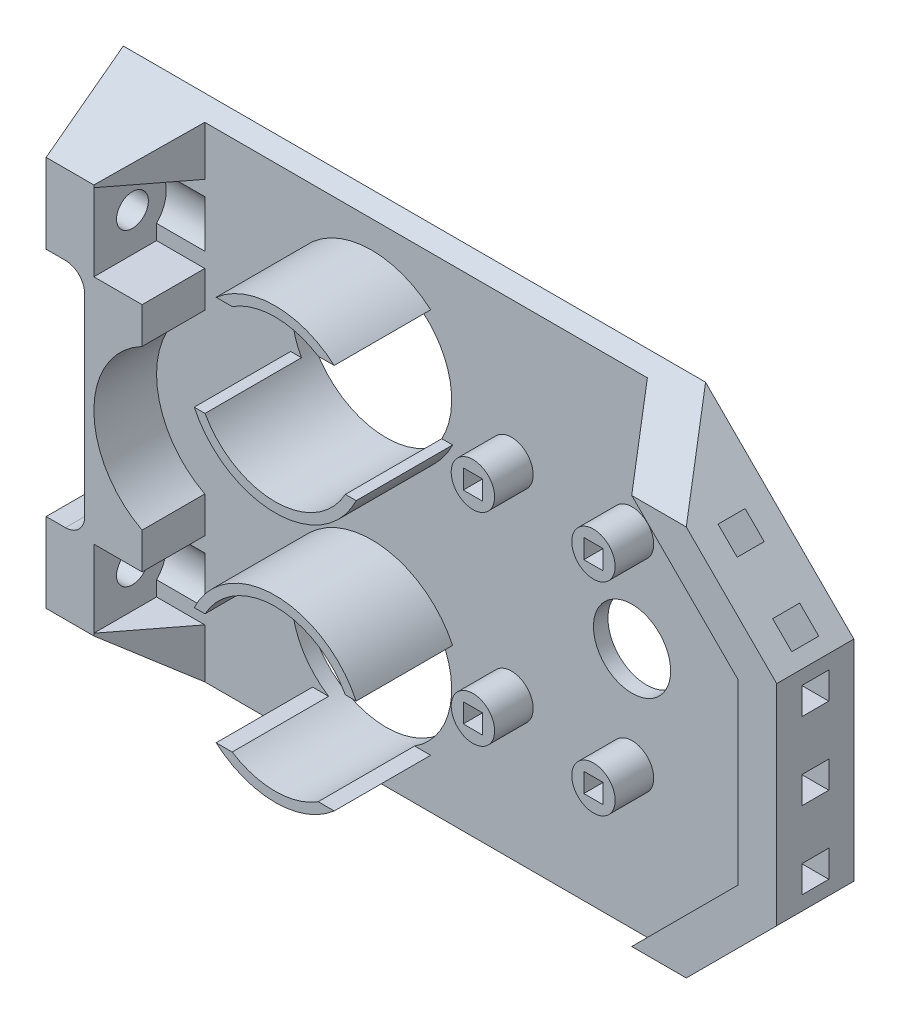
from build123d import *
from build123d.topology import SkipClean

# Parameters (mm, degrees)
ESBO_O1_R                 = 8.3
RESSALTO_EXTRUS_O1_DEPTH  = 1.5
RESSALTO_EXTRUS_O2_DEPTH  = 6
ESBO_O3_W                 = 2.8
ESBO_O3_H                 = 2.8
CORTE_EXTRUS_O1_DEPTH     = 37.142081
ESBO_O4_W                 = 2.8
ESBO_O4_H                 = 2.8
CORTE_EXTRUS_O2_DEPTH     = 53.081667
ESBO_O6_W                 = 5
ESBO_O6_H                 = 25
RESSALTO_EXTRUS_O5_DEPTH  = 7.5
ESBO_O7_W                 = 2.8
ESBO_O7_H                 = 2.8
CORTE_EXTRUS_O3_DEPTH     = 60
RESSALTO_EXTRUS_O3_DEPTH  = 10
ESBO_O8_W                 = 60
ESBO_O8_H                 = 52.5
ESBO_O8_R                 = 8.3
RESSALTO_EXTRUS_O6_DEPTH  = 1.5
CORTE_EXTRUS_O4_DEPTH     = 42.098206
RESSALTO_EXTRUS_O7_DEPTH  = 6.5
ESBO_O14_W                = 5.7
ESBO_O14_H                = 52.5
CORTE_EXTRUS_O8_DEPTH     = 4.5
CORTE_EXTRUS_O9_DEPTH     = 41.657871
CORTE_EXTRUS_O13_DEPTH    = 6.25
CORTE_EXTRUS_O14_DEPTH    = 6.25
ESBO_O12_R                = 1.65
CORTE_EXTRUS_O15_DEPTH    = 4.5
CORTE_EXTRUS_O17_DEPTH    = 62.398717
ESBO_O20_R                = 3.5
CORTE_EXTRUS_O18_DEPTH    = 5
RESSALTO_EXTRUS_O8_START  = 2.95
ESBO_O21_R                = 1.65
RESSALTO_EXTRUS_O8_DEPTH  = 2.95
ESBO_O22_W                = 2.8
ESBO_O22_H                = 2.8
RESSALTO_EXTRUS_O9_DEPTH  = 1.25
CORTE_EXTRUS_O19_DEPTH    = 6
ESBO_O24_W                = 8
ESBO_O24_H                = 50.25
RESSALTO_EXTRUS_O10_DEPTH = 6.5
CORTE_EXTRUS_O20_DEPTH    = 62.22257
CORTE_EXTRUS_O21_REACH    = 67.143
ESBO_O26_W                = 2.8
ESBO_O26_H                = 2.8
CORTE_EXTRUS_O22_REACH    = 67.143
CORTE_EXTRUS_O23_DEPTH    = 6.5
CORTE_EXTRUS_O24_DEPTH    = 43.019341
ESBO_O32_R                = 8.3
RESSALTO_EXTRUS_O11_DEPTH = 1.5
ESBO_O29_R                = 8.3
CORTE_EXTRUS_O27_DEPTH    = 42.588761
RESSALTO_EXTRUS_O12_DEPTH = 10
ESBO_O36_W                = 27.015234
ESBO_O36_H                = 55.93915
CORTE_EXTRUS_O28_DEPTH    = 10
RESSALTO_EXTRUS_O13_DEPTH = 1.5
ESBO_O40_R                = 2.25
RESSALTO_EXTRUS_O14_DEPTH = 4
ESBO_O37_R                = 4
ESBO_O37_W                = 2
ESBO_O37_H                = 2
CORTE_EXTRUS_O29_DEPTH    = 57.334381
ESBO_O41_W                = 2
ESBO_O41_H                = 2
RESSALTO_EXTRUS_O15_DEPTH = 1
RESSALTO_EXTRUS_O16_DEPTH = 6.5
ESBO_O44_W                = 2.8
ESBO_O44_H                = 2.8
CORTE_EXTRUS_O30_DEPTH    = 12.5
ESBO_O45_W                = 2.8
ESBO_O45_H                = 2.8
CORTE_EXTRUS_O31_DEPTH    = 5.5
ESBO_O46_W                = 2.8
ESBO_O46_H                = 2.8
CORTE_EXTRUS_O32_DEPTH    = 5.5
CORTE_EXTRUS_O33_START    = -40
CORTE_EXTRUS_O33_DEPTH    = 45.5
ESBO_O49_W                = 32.528758
ESBO_O49_H                = 8
CORTE_EXTRUS_O34_DEPTH    = 15.5


with BuildPart() as part:
    # Esboço1 → Ressalto-extrusão1 (new body)
    with BuildSketch(Plane.XY):
        Polygon((-25, -12.5), (-25, 12.5), (25, 12.5), (25, -12.5), (15, -12.5), (-15, -12.5), align=None)
        with Locations((-13, 0)):
            Circle(ESBO_O1_R, mode=Mode.SUBTRACT)
        with Locations(Location((13, 0, 0), (0, 0, 180))):
            Circle(ESBO_O1_R, mode=Mode.SUBTRACT)
    extrude(amount=RESSALTO_EXTRUS_O1_DEPTH)

    # Esboço2 → Ressalto-extrusão2 (add)
    with BuildSketch(Plane.XY.offset(1.5)):
        Polygon((-20, -12.5), (-25, -12.5), (-25, -2.5), (-22, -2.5), (-22, -9.5), (-15, -9.5), (-15, -12.5), align=None)
        Polygon((22, -2.5), (22, -9.5), (15, -9.5), (15, -12.5), (20, -12.5), (25, -12.5), (25, -2.5), align=None)
        Polygon((20, 12.5), (25, 12.5), (25, 2.5), (22, 2.5), (22, 9.5), (15, 9.5), (15, 12.5), align=None)
        Polygon((-22, 2.5), (-22, 9.5), (-15, 9.5), (-15, 12.5), (-20, 12.5), (-25, 12.5), (-25, 2.5), align=None)
    extrude(amount=RESSALTO_EXTRUS_O2_DEPTH)

    # Esboço3 → Corte-extrusão1 (cut, through all)
    with BuildSketch(Plane.XZ.offset(12.5)):
        with Locations((-20, 3.75)):
            Rectangle(ESBO_O3_W, ESBO_O3_H)
        with Locations((20, 3.75)):
            Rectangle(ESBO_O3_W, ESBO_O3_H)
    extrude(amount=-CORTE_EXTRUS_O1_DEPTH, mode=Mode.SUBTRACT)

    # Esboço4 → Corte-extrusão2 (cut, through all)
    with BuildSketch(Plane.ZY.offset(25)):
        with Locations((3.75, 7.5)):
            Rectangle(ESBO_O4_W, ESBO_O4_H)
        with Locations((3.75, -7.5)):
            Rectangle(ESBO_O4_W, ESBO_O4_H)
    extrude(amount=-CORTE_EXTRUS_O2_DEPTH, mode=Mode.SUBTRACT)

    # Esboço6 → Ressalto-extrusão5 (add)
    with BuildSketch(Plane(origin=(0, 0, 0), x_dir=(-1, 0, 0), z_dir=(0, 0, -1))):
        with Locations((-27.5, 0)):
            Rectangle(ESBO_O6_W, ESBO_O6_H)
        with Locations((27.5, 0)):
            Rectangle(ESBO_O6_W, ESBO_O6_H)
    extrude(amount=-RESSALTO_EXTRUS_O5_DEPTH)

    # Esboço7 → Corte-extrusão3 (cut)
    with BuildSketch(Plane(origin=(30, 0, 0), x_dir=(0, 0, -1), z_dir=(1, 0, 0))):
        with Locations((-3.75, -7.5)):
            Rectangle(ESBO_O7_W, ESBO_O7_H)
        with Locations((-3.75, 7.5)):
            Rectangle(ESBO_O7_W, ESBO_O7_H)
    extrude(amount=-CORTE_EXTRUS_O3_DEPTH, mode=Mode.SUBTRACT)

    # Esboço5 → Ressalto-extrusão3 (add)
    with SkipClean():  # the faces are left unmerged after this step: merging them gives an invalid solid
        with BuildSketch(Plane.XY.offset(1.5)):
            with BuildLine():
                Line((-9, -7.272551), (-9, -8.395832))
                ThreePointArc((-9, -8.395832), (-3.7, 0), (-9, 8.395832))
                Line((-9, 8.395832), (-9, 7.272551))
                ThreePointArc((-9, 7.272551), (-4.7, 0), (-9, -7.272551))
            make_face()
            with BuildLine():
                Line((-17, -7.272551), (-17, -8.395832))
                ThreePointArc((-17, -8.395832), (-22.3, 0), (-17, 8.395832))
                Line((-17, 8.395832), (-17, 7.272551))
                ThreePointArc((-17, 7.272551), (-21.3, 0), (-17, -7.272551))
            make_face()
            with BuildLine():
                Line((9, -7.272551), (9, -8.395832))
                ThreePointArc((9, -8.395832), (3.7, 0), (9, 8.395832))
                Line((9, 8.395832), (9, 7.272551))
                ThreePointArc((9, 7.272551), (4.7, 0), (9, -7.272551))
            make_face()
            with BuildLine():
                Line((17, 8.395832), (17, 7.272551))
                ThreePointArc((17, 7.272551), (21.3, 0), (17, -7.272551))
                Line((17, -7.272551), (17, -8.395832))
                ThreePointArc((17, -8.395832), (22.3, 0), (17, 8.395832))
            make_face()
        extrude(amount=RESSALTO_EXTRUS_O3_DEPTH)

    # Esboço8 → Ressalto-extrusão6 (add)
    with SkipClean():  # the faces are left unmerged after this step: merging them gives an invalid solid
        with BuildSketch(Plane(origin=(0, 0, 0), x_dir=(-1, 0, 0), z_dir=(0, 0, -1))):
            Rectangle(ESBO_O8_W, ESBO_O8_H)
            with Locations(Location((13, 0, 0), (0, 0, 298.81138))):
                Circle(ESBO_O8_R, mode=Mode.SUBTRACT)
            with Locations((-13, 0)):
                Circle(ESBO_O8_R, mode=Mode.SUBTRACT)
        extrude(amount=-RESSALTO_EXTRUS_O6_DEPTH)

    # Esboço9 → Corte-extrusão4 (cut, through all)
    with SkipClean():  # the faces are left unmerged after this step: merging them gives an invalid solid
        with BuildSketch(Plane.XY.offset(1.5)):
            Polygon((-15, -12.5), (-15, -9.5), (-22, -9.5), (-22, -2.5), (-25, -2.5), (-25, 2.5), (-22, 2.5), (-22, 9.5), (-15, 9.5), (-15, 12.5), (-30, 12.5), (-30, -12.5), align=None)
        extrude(amount=CORTE_EXTRUS_O4_DEPTH, mode=Mode.SUBTRACT)

    # Esboço10 → Ressalto-extrusão7 (add)
    with SkipClean():  # the faces are left unmerged after this step: merging them gives an invalid solid
        with BuildSketch(Plane.XY.offset(1.5)):
            Polygon((-24.3, -26.25), (-24.3, 26.25), (-22.3, 26.25), (-17.3, 26.25), (-17.3, 20), (-22.3, 20), (-22.3, 12), (-17.3, 12), (-17.3, -12), (-22.3, -12), (-22.3, -20), (-17.3, -20), (-17.3, -26.25), (-22.3, -26.25), align=None)
        extrude(amount=RESSALTO_EXTRUS_O7_DEPTH)

    # Esboço14 → Corte-extrusão8 (cut)
    with SkipClean():  # the faces are left unmerged after this step: merging them gives an invalid solid
        with BuildSketch(Plane.XY.offset(1.5)):
            with Locations((-27.15, 0)):
                Rectangle(ESBO_O14_W, ESBO_O14_H)
        extrude(amount=-CORTE_EXTRUS_O8_DEPTH, mode=Mode.SUBTRACT)

    # Esboço15 → Corte-extrusão9 (cut, through all)
    with SkipClean():  # the faces are left unmerged after this step: merging them gives an invalid solid
        with BuildSketch(Plane.XY.offset(8)):
            with BuildLine():
                Line((-17.3, -7.099296), (-17.3, 7.099296))
                ThreePointArc((-17.3, 7.099296), (-21.3, 0), (-17.3, -7.099296))
            make_face()
        extrude(amount=-CORTE_EXTRUS_O9_DEPTH, mode=Mode.SUBTRACT)

    # Esboço11 → Corte-extrusão13 (cut)
    with SkipClean():  # the faces are left unmerged after this step: merging them gives an invalid solid
        with BuildSketch(Plane.XZ.offset(26.25)):
            Polygon((-22.3, 8), (-17.3, 8), (-17.3, 1.5), align=None)
        extrude(amount=-CORTE_EXTRUS_O13_DEPTH, mode=Mode.SUBTRACT)

    # Esboço17 → Corte-extrusão14 (cut)
    with SkipClean():  # the faces are left unmerged after this step: merging them gives an invalid solid
        with BuildSketch(Plane(origin=(0, 26.25, 0), x_dir=(1, 0, 0), z_dir=(0, 1, 0))):
            Polygon((-17.3, -1.5), (-17.3, -8), (-22.3, -8), align=None)
        extrude(amount=-CORTE_EXTRUS_O14_DEPTH, mode=Mode.SUBTRACT)

    # Esboço12 → Corte-extrusão15 (cut)
    with SkipClean():  # the faces are left unmerged after this step: merging them gives an invalid solid
        with BuildSketch(Plane.ZY.offset(24.3)):
            with Locations(Location((4, 16, 0), (0, 0, 270))):
                Circle(ESBO_O12_R)
            with Locations((4, -16)):
                Circle(ESBO_O12_R)
        extrude(amount=-CORTE_EXTRUS_O15_DEPTH, mode=Mode.SUBTRACT)

    # Esboço19 → Corte-extrusão17 (cut, through all)
    with SkipClean():  # the faces are left unmerged after this step: merging them gives an invalid solid
        with BuildSketch(Plane.ZY.offset(24.3)):
            Polygon((0, 26.25), (8, 26.25), (8, 20.25), align=None)
            Polygon((8, -20.25), (0, -26.25), (8, -26.25), align=None)
        extrude(amount=-CORTE_EXTRUS_O17_DEPTH, mode=Mode.SUBTRACT)

    # Esboço20 → Corte-extrusão18 (cut)
    with SkipClean():  # the faces are left unmerged after this step: merging them gives an invalid solid
        with BuildSketch(Plane(origin=(-22.3, 0, 0), x_dir=(0, 0, -1), z_dir=(1, 0, 0))):
            with Locations((-4, -16)):
                Circle(ESBO_O20_R)
            with Locations((-4, 16)):
                Circle(ESBO_O20_R)
        extrude(amount=CORTE_EXTRUS_O18_DEPTH, mode=Mode.SUBTRACT)

    # Esboço21 → Ressalto-extrusão8 (add)
    with SkipClean():  # the faces are left unmerged after this step: merging them gives an invalid solid
        with BuildSketch(Plane.ZY.offset(24.3).offset(RESSALTO_EXTRUS_O8_START)):
            Polygon((0, 26.25), (0, -26.25), (8, -20.25), (8, 20.25), align=None)
            with Locations(Location((4, -16, 0), (0, 0, 270))):
                Circle(ESBO_O21_R, mode=Mode.SUBTRACT)
            with Locations(Location((4, 16, 0), (0, 0, 270))):
                Circle(ESBO_O21_R, mode=Mode.SUBTRACT)
        extrude(amount=-RESSALTO_EXTRUS_O8_DEPTH)

    # Esboço22 → Ressalto-extrusão9 (add)
    with SkipClean():  # the faces are left unmerged after this step: merging them gives an invalid solid
        with BuildSketch(Plane(origin=(30, 0, 0), x_dir=(0, 0, -1), z_dir=(1, 0, 0))):
            Polygon((-1.5, -25.125), (0, -26.25), (0, 26.25), (-1.5, 25.125), (-1.5, 12.5), (-7.5, 12.5), (-7.5, -12.5), (-1.5, -12.5), align=None)
            with Locations((-3.75, -7.5)):
                Rectangle(ESBO_O22_W, ESBO_O22_H, mode=Mode.SUBTRACT)
            with Locations((-3.75, 7.5)):
                Rectangle(ESBO_O22_W, ESBO_O22_H, mode=Mode.SUBTRACT)
        extrude(amount=RESSALTO_EXTRUS_O9_DEPTH)

    # Esboço23 → Corte-extrusão19 (cut)
    with SkipClean():  # the faces are left unmerged after this step: merging them gives an invalid solid
        with BuildSketch(Plane.XY.offset(7.5)):
            Polygon((25, -2.5), (22, -2.5), (22, -9.5), (15, -9.5), (15, -12.5), (31.25, -12.5), (31.25, 12.5), (15, 12.5), (15, 9.5), (22, 9.5), (22, 2.5), (25, 2.5), align=None)
        extrude(amount=-CORTE_EXTRUS_O19_DEPTH, mode=Mode.SUBTRACT)

    # Esboço24 → Ressalto-extrusão10 (add)
    with SkipClean():  # the faces are left unmerged after this step: merging them gives an invalid solid
        with BuildSketch(Plane.XY.offset(1.5)):
            with Locations((27.25, 0)):
                Rectangle(ESBO_O24_W, ESBO_O24_H)
        extrude(amount=RESSALTO_EXTRUS_O10_DEPTH)

    # Esboço25 → Corte-extrusão20 (cut, through all)
    with SkipClean():  # the faces are left unmerged after this step: merging them gives an invalid solid
        with BuildSketch(Plane(origin=(0, 25.125, 0), x_dir=(1, 0, 0), z_dir=(0, 1, 0))):
            Polygon((23.25, -6.5), (23.25, -8), (24.75, -8), align=None)
        extrude(amount=-CORTE_EXTRUS_O20_DEPTH, mode=Mode.SUBTRACT)

    # Esboço26 → Corte-extrusão21 (cut, up to next)
    with BuildSketch(Plane(origin=(31.25, 0, 0), x_dir=(0, 0, -1), z_dir=(1, 0, 0)), mode=Mode.PRIVATE) as corte_extrus_o21_sk1:
        with Locations((-4, 0)):
            Rectangle(ESBO_O26_W, ESBO_O26_H)
    corte_extrus_o21_tool1 = extrude(corte_extrus_o21_sk1.sketch, amount=-CORTE_EXTRUS_O21_REACH, mode=Mode.PRIVATE) & part.part
    # Esboço26 → Corte-extrusão21 (cut, up to next)
    with BuildSketch(Plane(origin=(31.25, 0, 0), x_dir=(0, 0, -1), z_dir=(1, 0, 0)), mode=Mode.PRIVATE) as corte_extrus_o21_sk2:
        with Locations((-4, -8)):
            Rectangle(ESBO_O26_W, ESBO_O26_H)
    corte_extrus_o21_tool2 = extrude(corte_extrus_o21_sk2.sketch, amount=-CORTE_EXTRUS_O21_REACH, mode=Mode.PRIVATE) & part.part
    # Esboço26 → Corte-extrusão21 (cut, up to next)
    with BuildSketch(Plane(origin=(31.25, 0, 0), x_dir=(0, 0, -1), z_dir=(1, 0, 0)), mode=Mode.PRIVATE) as corte_extrus_o21_sk3:
        with Locations((-4, 8)):
            Rectangle(ESBO_O26_W, ESBO_O26_H)
    corte_extrus_o21_tool3 = extrude(corte_extrus_o21_sk3.sketch, amount=-CORTE_EXTRUS_O21_REACH, mode=Mode.PRIVATE) & part.part
    add(corte_extrus_o21_tool1.solids().sort_by_distance((31.25, 0, 4))[0], mode=Mode.SUBTRACT)
    add(corte_extrus_o21_tool2.solids().sort_by_distance((31.25, -8, 4))[0], mode=Mode.SUBTRACT)
    add(corte_extrus_o21_tool3.solids().sort_by_distance((31.25, 8, 4))[0], mode=Mode.SUBTRACT)

    # Esboço27 → Corte-extrusão22 (cut, up to next)
    with BuildSketch(Plane(origin=(31.25, 0, 0), x_dir=(0, 0, -1), z_dir=(1, 0, 0)), mode=Mode.PRIVATE) as corte_extrus_o22_sk1:
        with BuildLine():
            Line((-4, 19), (-8, 19))
            Line((-8, 19), (-8, 13))
            Line((-8, 13), (-4, 13))
            ThreePointArc((-4, 13), (-2.581363, 13.356618), (-1.5, 14.341688))
            Line((-1.5, 14.341688), (-1.5, 17.658312))
            ThreePointArc((-1.5, 17.658312), (-2.581363, 18.643382), (-4, 19))
        make_face()
    corte_extrus_o22_tool1 = extrude(corte_extrus_o22_sk1.sketch, amount=-CORTE_EXTRUS_O22_REACH, mode=Mode.PRIVATE) & part.part
    # Esboço27 → Corte-extrusão22 (cut, up to next)
    with BuildSketch(Plane(origin=(31.25, 0, 0), x_dir=(0, 0, -1), z_dir=(1, 0, 0)), mode=Mode.PRIVATE) as corte_extrus_o22_sk2:
        Polygon((-8, -20.25), (-8, -25.125), (-1.5, -25.125), align=None)
    corte_extrus_o22_tool2 = extrude(corte_extrus_o22_sk2.sketch, amount=-CORTE_EXTRUS_O22_REACH, mode=Mode.PRIVATE) & part.part
    # Esboço27 → Corte-extrusão22 (cut, up to next)
    with BuildSketch(Plane(origin=(31.25, 0, 0), x_dir=(0, 0, -1), z_dir=(1, 0, 0)), mode=Mode.PRIVATE) as corte_extrus_o22_sk3:
        Polygon((-8, 25.125), (-8, 20.25), (-1.5, 25.125), align=None)
    corte_extrus_o22_tool3 = extrude(corte_extrus_o22_sk3.sketch, amount=-CORTE_EXTRUS_O22_REACH, mode=Mode.PRIVATE) & part.part
    # Esboço27 → Corte-extrusão22 (cut, up to next)
    with BuildSketch(Plane(origin=(31.25, 0, 0), x_dir=(0, 0, -1), z_dir=(1, 0, 0)), mode=Mode.PRIVATE) as corte_extrus_o22_sk4:
        with BuildLine():
            Line((-4, -13), (-8, -13))
            Line((-8, -13), (-8, -19))
            Line((-8, -19), (-4, -19))
            ThreePointArc((-4, -19), (-2.581363, -18.643382), (-1.5, -17.658312))
            Line((-1.5, -17.658312), (-1.5, -14.341688))
            ThreePointArc((-1.5, -14.341688), (-2.581363, -13.356618), (-4, -13))
        make_face()
    corte_extrus_o22_tool4 = extrude(corte_extrus_o22_sk4.sketch, amount=-CORTE_EXTRUS_O22_REACH, mode=Mode.PRIVATE) & part.part
    add(corte_extrus_o22_tool1.solids().sort_by_distance((31.25, 16, 4.892695))[0], mode=Mode.SUBTRACT)
    add(corte_extrus_o22_tool2.solids().sort_by_distance((31.25, -23.5, 5.833333))[0], mode=Mode.SUBTRACT)
    add(corte_extrus_o22_tool3.solids().sort_by_distance((31.25, 23.5, 5.833333))[0], mode=Mode.SUBTRACT)
    add(corte_extrus_o22_tool4.solids().sort_by_distance((31.25, -16, 4.892695))[0], mode=Mode.SUBTRACT)

    # Esboço28 → Corte-extrusão23 (cut)
    with SkipClean():  # the faces are left unmerged after this step: merging them gives an invalid solid
        with BuildSketch(Plane.XY.offset(8)):
            with BuildLine():
                Line((-27.25, 0), (-27.25, 8))
                Line((-27.25, 8), (-27.25, 12))
                Line((-27.25, 12), (-25.25, 12))
                ThreePointArc((-25.25, 12), (-23.835786, 11.414214), (-23.25, 10))
                Line((-23.25, 10), (-23.25, -10))
                ThreePointArc((-23.25, -10), (-23.835786, -11.414214), (-25.25, -12))
                Line((-25.25, -12), (-27.25, -12))
                Line((-27.25, -12), (-27.25, 0))
            make_face()
        extrude(amount=-CORTE_EXTRUS_O23_DEPTH, mode=Mode.SUBTRACT)

    # Esboço31 → Corte-extrusão24 (cut, through all)
    with BuildSketch(Plane.XY.offset(1.5)):
        with BuildLine():
            Line((-9, -7.272551), (-9, -8.395832))
            ThreePointArc((-9, -8.395832), (-3.7, 0), (-9, 8.395832))
            Line((-9, 8.395832), (-9, 7.272551))
            ThreePointArc((-9, 7.272551), (-4.7, 0), (-9, -7.272551))
        make_face()
        with BuildLine():
            Line((-17, 7.272551), (-17, 8.395832))
            ThreePointArc((-17, 8.395832), (-22.3, 0), (-17, -8.395832))
            Line((-17, -8.395832), (-17, -7.272551))
            ThreePointArc((-17, -7.272551), (-21.3, 0), (-17, 7.272551))
        make_face()
        with BuildLine():
            Line((17, 8.395832), (17, 7.272551))
            ThreePointArc((17, 7.272551), (21.3, 0), (17, -7.272551))
            Line((17, -7.272551), (17, -8.395832))
            ThreePointArc((17, -8.395832), (22.3, 0), (17, 8.395832))
        make_face()
        with BuildLine():
            Line((9, -8.395832), (9, -7.272551))
            ThreePointArc((9, -7.272551), (4.7, 0), (9, 7.272551))
            Line((9, 7.272551), (9, 8.395832))
            ThreePointArc((9, 8.395832), (3.7, 0), (9, -8.395832))
        make_face()
    extrude(amount=CORTE_EXTRUS_O24_DEPTH, mode=Mode.SUBTRACT)

    # Esboço32 → Ressalto-extrusão11 (add)
    with BuildSketch(Plane(origin=(0, 0, 0), x_dir=(-1, 0, 0), z_dir=(0, 0, -1))):
        with Locations((-13, 0)):
            Circle(ESBO_O32_R)
        with Locations((13, 0)):
            Circle(ESBO_O32_R)
    extrude(amount=-RESSALTO_EXTRUS_O11_DEPTH)

    # Esboço29 → Corte-extrusão27 (cut, through all)
    with BuildSketch(Plane.XY):
        with Locations((0, -13)):
            Circle(ESBO_O29_R)
        with Locations(Location((0, 13, 0), (0, 0, 180))):
            Circle(ESBO_O29_R)
    extrude(amount=CORTE_EXTRUS_O27_DEPTH, mode=Mode.SUBTRACT)

    # Esboço30 → Ressalto-extrusão12 (add)
    with BuildSketch(Plane.XY.offset(1.5)):
        with BuildLine():
            Line((7.272551, -9), (8.395832, -9))
            ThreePointArc((8.395832, -9), (0, -3.7), (-8.395832, -9))
            Line((-8.395832, -9), (-7.272551, -9))
            ThreePointArc((-7.272551, -9), (0, -4.7), (7.272551, -9))
        make_face()
        with BuildLine():
            Line((7.272551, -17), (8.395832, -17))
            ThreePointArc((8.395832, -17), (0, -22.3), (-8.395832, -17))
            Line((-8.395832, -17), (-7.272551, -17))
            ThreePointArc((-7.272551, -17), (0, -21.3), (7.272551, -17))
        make_face()
        with BuildLine():
            Line((7.272551, 9), (8.395832, 9))
            ThreePointArc((8.395832, 9), (0, 3.7), (-8.395832, 9))
            Line((-8.395832, 9), (-7.272551, 9))
            ThreePointArc((-7.272551, 9), (0, 4.7), (7.272551, 9))
        make_face()
        with BuildLine():
            Line((-8.395832, 17), (-7.272551, 17))
            ThreePointArc((-7.272551, 17), (0, 21.3), (7.272551, 17))
            Line((7.272551, 17), (8.395832, 17))
            ThreePointArc((8.395832, 17), (0, 22.3), (-8.395832, 17))
        make_face()
    extrude(amount=RESSALTO_EXTRUS_O12_DEPTH)

    # Esboço36 → Corte-extrusão28 (cut)
    with BuildSketch(Plane.XY.offset(1.5)):
        with Locations((23.25, 0)):
            Rectangle(ESBO_O36_W, ESBO_O36_H)
    extrude(amount=CORTE_EXTRUS_O28_DEPTH, mode=Mode.SUBTRACT)

    # Esboço39 → Ressalto-extrusão13 (add)
    with BuildSketch(Plane(origin=(0, 0, 0), x_dir=(-1, 0, 0), z_dir=(0, 0, -1))):
        Polygon((-31.25, 26.25), (-33.123106, 26.25), (-48.5, 10.873106), (-48.5, -10.873106), (-33.123106, -26.25), (-31.25, -26.25), align=None)
    extrude(amount=-RESSALTO_EXTRUS_O13_DEPTH)

    # Esboço40 → Ressalto-extrusão14 (add)
    with BuildSketch(Plane.XY.offset(1.5)):
        with Locations((27, 10.5)):
            Circle(ESBO_O40_R)
        with Locations((27, -10.5)):
            Circle(ESBO_O40_R)
        with Locations((14.5, -10.5)):
            Circle(ESBO_O40_R)
        with Locations((14.5, 10.5)):
            Circle(ESBO_O40_R)
    extrude(amount=RESSALTO_EXTRUS_O14_DEPTH)

    # Esboço37 → Corte-extrusão29 (cut, through all)
    with BuildSketch(Plane.XY):
        with Locations((27, 0)):
            Circle(ESBO_O37_R)
        with Locations((14.5, -10.5)):
            Rectangle(ESBO_O37_W, ESBO_O37_H)
        with Locations((14.5, 10.5)):
            Rectangle(ESBO_O37_W, ESBO_O37_H)
        with Locations((27, 10.5)):
            Rectangle(ESBO_O37_W, ESBO_O37_H)
        with Locations((27, -10.5)):
            Rectangle(ESBO_O37_W, ESBO_O37_H)
    extrude(amount=CORTE_EXTRUS_O29_DEPTH, mode=Mode.SUBTRACT)

    # Esboço41 → Ressalto-extrusão15 (add)
    with BuildSketch(Plane(origin=(0, 0, 0), x_dir=(-1, 0, 0), z_dir=(0, 0, -1))):
        with Locations((-27, -10.5)):
            Rectangle(ESBO_O41_W, ESBO_O41_H)
        with Locations((-14.5, -10.5)):
            Rectangle(ESBO_O41_W, ESBO_O41_H)
        with Locations((-14.5, 10.5)):
            Rectangle(ESBO_O41_W, ESBO_O41_H)
        with Locations((-27, 10.5)):
            Rectangle(ESBO_O41_W, ESBO_O41_H)
    extrude(amount=-RESSALTO_EXTRUS_O15_DEPTH)

    # Esboço43 → Ressalto-extrusão16 (add)
    with BuildSketch(Plane.XY.offset(1.5)):
        Polygon((33.123106, 26.25), (48.5, 10.873106), (48.5, -10.873106), (33.123106, -26.25), (27.466252, -26.25), (30.294679, -23.421573), (44.5, -9.216252), (44.5, 9.216252), (30.294679, 23.421573), (27.466252, 26.25), align=None)
    extrude(amount=RESSALTO_EXTRUS_O16_DEPTH)

    # Esboço44 → Corte-extrusão30 (cut)
    with BuildSketch(Plane(origin=(48.5, 0, 0), x_dir=(0, 0, -1), z_dir=(1, 0, 0))):
        with Locations((-4, 0)):
            Rectangle(ESBO_O44_W, ESBO_O44_H)
        with Locations((-4, 8)):
            Rectangle(ESBO_O44_W, ESBO_O44_H)
        with Locations((-4, -8)):
            Rectangle(ESBO_O44_W, ESBO_O44_H)
    extrude(amount=-CORTE_EXTRUS_O30_DEPTH, mode=Mode.SUBTRACT)

    # Esboço45 → Corte-extrusão31 (cut)
    with BuildSketch(Plane(origin=(29.686553, -29.686553, 0), x_dir=(0, 0, -1), z_dir=(0.7071067811865464, -0.7071067811865488, 0))):
        with Locations((-4, 23.733126)):
            Rectangle(ESBO_O45_W, ESBO_O45_H)
        with Locations((-4, 15.733126)):
            Rectangle(ESBO_O45_W, ESBO_O45_H)
    extrude(amount=-CORTE_EXTRUS_O31_DEPTH, mode=Mode.SUBTRACT)

    # Esboço46 → Corte-extrusão32 (cut)
    with BuildSketch(Plane(origin=(29.686553, 29.686553, 0), x_dir=(0, 0, -1), z_dir=(0.7071067811865465, 0.7071067811865487, 0))):
        with Locations((-4, -15.733126)):
            Rectangle(ESBO_O46_W, ESBO_O46_H)
        with Locations((-4, -23.733126)):
            Rectangle(ESBO_O46_W, ESBO_O46_H)
    extrude(amount=-CORTE_EXTRUS_O32_DEPTH, mode=Mode.SUBTRACT)

    # Esboço48 → Corte-extrusão33 (cut)
    with BuildSketch(Plane.ZY.offset(27.25).offset(CORTE_EXTRUS_O33_START)):
        Polygon((8, 20.25), (0, 26.25), (0, 28.89363), (17.975582, 28.89363), (17.975582, 20.25), align=None)
        Polygon((0, -26.25), (8, -20.25), (14.919184, -20.25), (14.919184, -29.675499), (0, -29.675499), align=None)
    extrude(amount=-CORTE_EXTRUS_O33_DEPTH, mode=Mode.SUBTRACT)

    # Esboço49 → Corte-extrusão34 (cut)
    with BuildSketch(Plane.XY.offset(1.5)):
        with Locations((-6.035621, 16)):
            Rectangle(ESBO_O49_W, ESBO_O49_H)
        with Locations((-6.035621, -16)):
            Rectangle(ESBO_O49_W, ESBO_O49_H)
    extrude(amount=CORTE_EXTRUS_O34_DEPTH, mode=Mode.SUBTRACT)


solid = part.part
